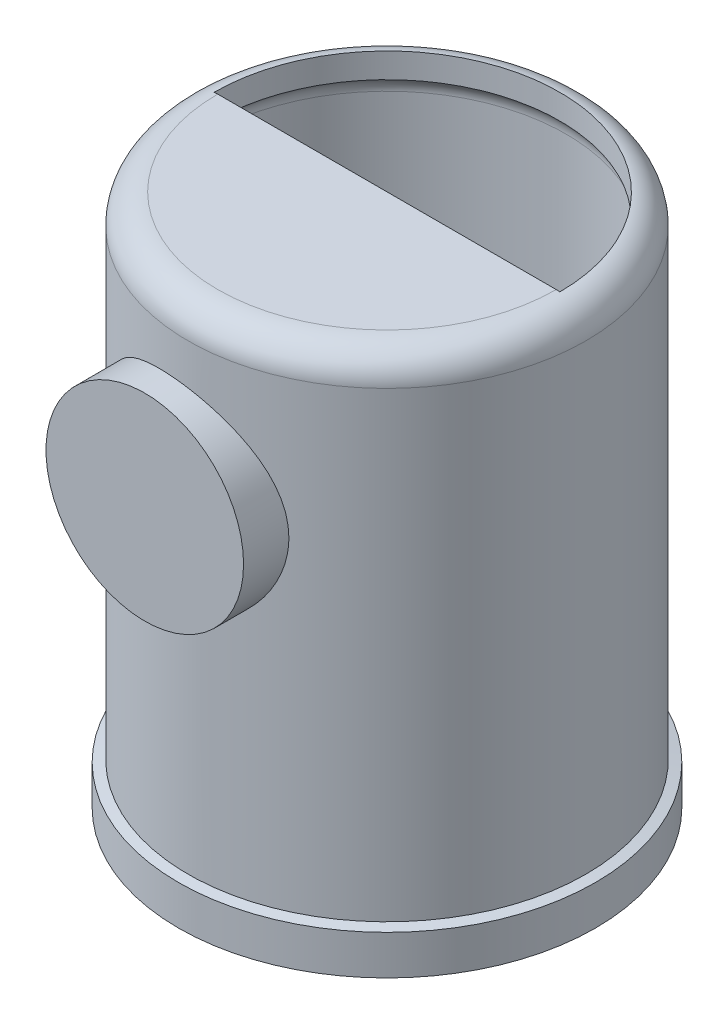
from build123d import *

# Parameters (mm, degrees)
SKETCH4_R           = 10
BOSS_EXTRUDE2_DEPTH = 6
CUT_EXTRUDE2_DEPTH  = 40


with BuildPart() as part:
    # Sketch1 → Revolve1 (revolve)
    with BuildSketch(Plane.XY):
        with BuildLine():
            Line((20.9, 0), (23.871591838, 0))
            Line((23.871591838, 0), (23.871591838, 4))
            Line((23.871591838, 4), (22.9, 4.236662843))
            Line((22.9, 4.236662843), (22.9, 51))
            ThreePointArc((22.9, 51), (22.021320344, 53.121320344), (19.9, 54))
            Line((19.9, 54), (2.764914955, 54))
            Line((2.764914955, 54), (2.764914955, 52))
            Line((2.764914955, 52), (18.9, 52))
            ThreePointArc((18.9, 52), (20.314213562, 51.414213562), (20.9, 50))
            Line((20.9, 50), (20.9, 17))
            Line((20.9, 17), (2.764914955, 17))
            Line((2.764914955, 17), (2.764914955, 15))
            Line((2.764914955, 15), (20.9, 15))
            Line((20.9, 15), (20.9, 0))
        make_face()
    revolve(axis=Axis((2.764914955, 7.821821657, 0), (0, 1, 0)))

    # Sketch4 → Boss-Extrude2 (add)
    with BuildSketch(Plane.XY.offset(22.9)):
        with Locations((1.144629865, 37)):
            Circle(SKETCH4_R)
    extrude(amount=-BOSS_EXTRUDE2_DEPTH)

    # Sketch9 → Cut-Extrude2 (cut)
    with BuildSketch(Plane(origin=(0, 54, 0), x_dir=(1, 0, 0), z_dir=(0, 1, 0))):
        with BuildLine():
            Line((-14.735084994, -0.001327718), (20.264915006, -0.001327718))
            ThreePointArc((20.264915006, -0.001327718), (2.764915006, 17.498672282), (-14.735084994, -0.001327718))
        make_face()
    extrude(amount=-CUT_EXTRUDE2_DEPTH, mode=Mode.SUBTRACT)


solid = part.part
